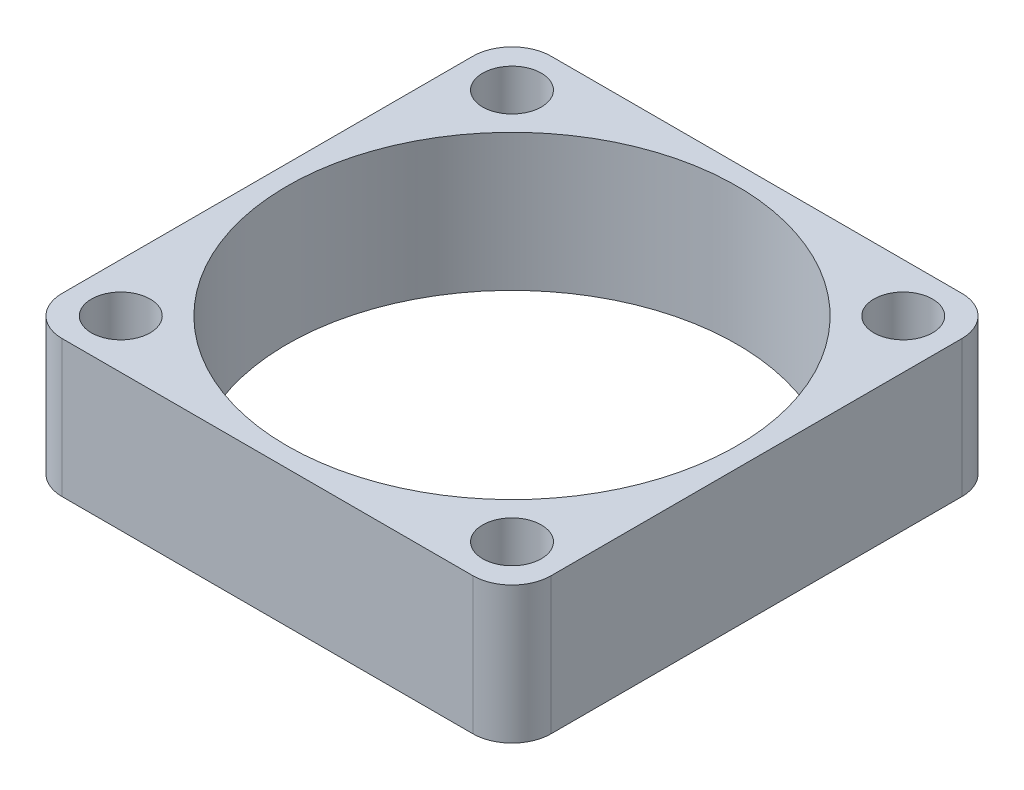
from build123d import *

# Parameters (mm, degrees)
SKETCH_1_W          = 25
SKETCH_1_H          = 25
SKETCH_1_R          = 1.5
EXTRUDE_1_DEPTH     = 7
FILLET_1_R          = 2
SKETCH_2_R          = 11.5
CUT_EXTRUDE_1_DEPTH = 7


with BuildPart() as part:
    # 草图1 → 凸台-拉伸1 (new body)
    with BuildSketch(Plane(origin=(0, 0, 0), x_dir=(1, 0, 0), z_dir=(0, 1, 0))):
        Rectangle(SKETCH_1_W, SKETCH_1_H)
        with Locations(Location((-10, -10, 0), (0, 0, 270))):
            Circle(SKETCH_1_R, mode=Mode.SUBTRACT)
        with Locations(Location((10, -10, 0), (0, 0, 270))):
            Circle(SKETCH_1_R, mode=Mode.SUBTRACT)
        with Locations(Location((10, 10, 0), (0, 0, 270))):
            Circle(SKETCH_1_R, mode=Mode.SUBTRACT)
        with Locations(Location((-10, 10, 0), (0, 0, 270))):
            Circle(SKETCH_1_R, mode=Mode.SUBTRACT)
    extrude(amount=EXTRUDE_1_DEPTH)

    # 圆角1
    fillet_1_edges = [part.edges().sort_by_distance(p)[0] for p in [
        (12.5, 3.5, 12.5),
        (-12.5, 3.5, 12.5),
        (-12.5, 3.5, -12.5),
        (12.5, 3.5, -12.5),
    ]]
    fillet(fillet_1_edges, radius=FILLET_1_R)

    # 草图2 → 切除-拉伸1 (cut)
    with BuildSketch(Plane(origin=(0, 7, 0), x_dir=(1, 0, 0), z_dir=(0, 1, 0))):
        with Locations(Location((0, 0, 0), (0, 0, 270))):
            Circle(SKETCH_2_R)
    extrude(amount=-CUT_EXTRUDE_1_DEPTH, mode=Mode.SUBTRACT)


solid = part.part
